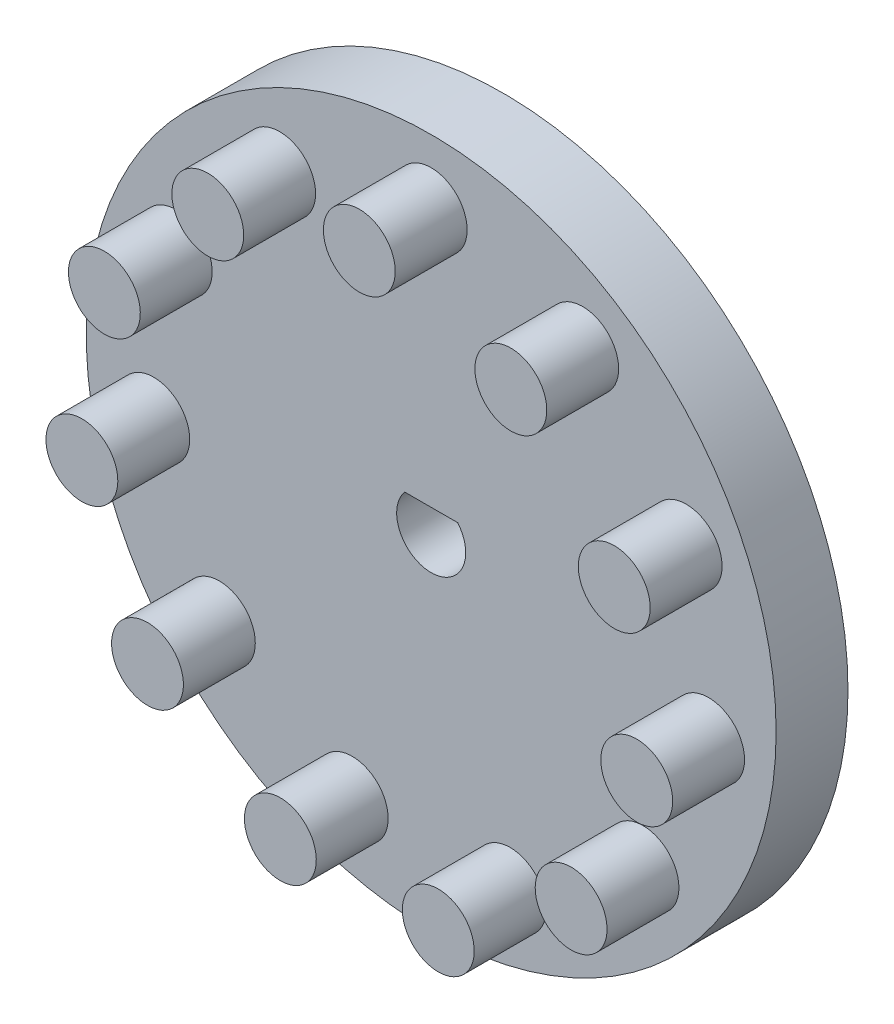
from build123d import *

# Parameters (mm, degrees)
SKETCH1_R           = 15.24
SKETCH1_R_2         = 1.5875
BOSS_EXTRUDE1_DEPTH = 3.175
SKETCH1_3_R         = 1.5875
BOSS_EXTRUDE2_DEPTH = 6.35
CIRPATTERN1_COUNT   = 11


with BuildPart() as part:
    # Sketch1 → Boss-Extrude1 (new body)
    with BuildSketch(Plane.XY):
        Circle(SKETCH1_R)
        with Locations((0, 12.3825)):
            Circle(SKETCH1_R_2, mode=Mode.SUBTRACT)
        with BuildLine():
            Line((-1.1725, 0.975124992), (1.1725, 0.975124992))
            ThreePointArc((1.1725, 0.975124992), (0, -1.525), (-1.1725, 0.975124992))
        make_face(mode=Mode.SUBTRACT)
    extrude(amount=BOSS_EXTRUDE1_DEPTH)

    # Sketch1<3> → Boss-Extrude2 (add)
    with BuildSketch(Plane.XY):
        with Locations((0, 12.3825)):
            Circle(SKETCH1_3_R)
    boss_extrude2 = extrude(amount=BOSS_EXTRUDE2_DEPTH)

    # CirPattern1: Boss-Extrude2 ×11 about axis
    cirpattern1_axis = Axis((0, 0, 0), (0, 0, 1))
    for i in range(1, CIRPATTERN1_COUNT):
        add(boss_extrude2.rotate(cirpattern1_axis, i * 360 / CIRPATTERN1_COUNT))


solid = part.part
